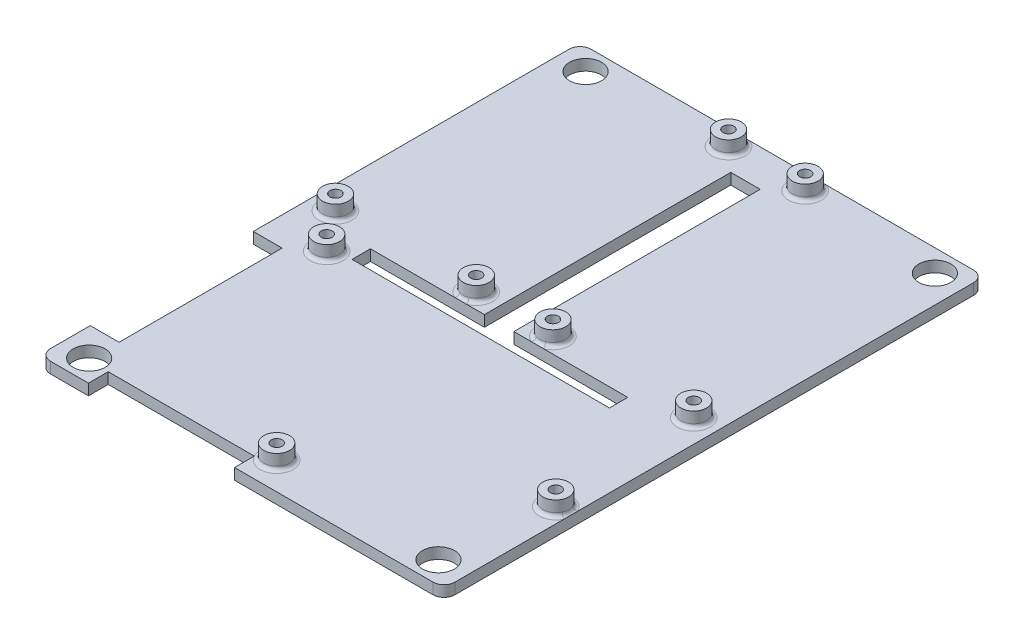
from build123d import *

# Parameters (mm, degrees)
CROQUIS1_W              = 110
CROQUIS1_H              = 147
CROQUIS1_R              = 4.35
SALIENTE_EXTRUIR1_DEPTH = 3
CROQUIS3_R              = 3.5
CROQUIS3_R_2            = 1.5
SALIENTE_EXTRUIR2_DEPTH = 4
REDONDEO1_R             = 3
REDONDEO2_R             = 1
CROQUIS4_W              = 39.735269825
CROQUIS4_H              = 5.382394585
CROQUIS4_W_2            = 7.840880328
CROQUIS4_H_2            = 44.360539328
CORTAR_EXTRUIR1_DEPTH   = 184.643676864


with BuildPart() as part:
    # Croquis1 → Saliente-Extruir1 (new body)
    with BuildSketch(Plane(origin=(0, 0, 0), x_dir=(1, 0, 0), z_dir=(0, 1, 0))):
        with Locations((55, 73.5)):
            Rectangle(CROQUIS1_W, CROQUIS1_H)
        with Locations(Location((7.5, 141, 0), (0, 0, 270))):
            Circle(CROQUIS1_R, mode=Mode.SUBTRACT)
        with Locations(Location((102.5, 141, 0), (0, 0, 270))):
            Circle(CROQUIS1_R, mode=Mode.SUBTRACT)
        with Locations(Location((102.5, 6, 0), (0, 0, 270))):
            Circle(CROQUIS1_R, mode=Mode.SUBTRACT)
        with Locations(Location((7.5, 6, 0), (0, 0, 270))):
            Circle(CROQUIS1_R, mode=Mode.SUBTRACT)
        Polygon((90, 65), (20, 65), (20, 70), (51, 70), (51, 137), (59, 137), (59, 70), (90, 70), align=None, mode=Mode.SUBTRACT)
    extrude(amount=SALIENTE_EXTRUIR1_DEPTH)

    # Croquis3 → Saliente-Extruir2 (add)
    # profile 1 of 9: a face of its own
    with BuildSketch(Plane(origin=(0, 3, 0), x_dir=(1, 0, 0), z_dir=(0, 1, 0))):
        with Locations(Location((14.6, 63.5, 0), (0, 0, 90))):
            Circle(CROQUIS3_R)
        with Locations(Location((14.6, 63.5, 0), (0, 0, 270))):
            Circle(CROQUIS3_R_2, mode=Mode.SUBTRACT)
    # profile 2 of 9: a face of its own
    with BuildSketch(Plane(origin=(0, 3, 0), x_dir=(1, 0, 0), z_dir=(0, 1, 0))):
        with Locations(Location((6.275, 74.2, 0), (0, 0, 90))):
            Circle(CROQUIS3_R)
        with Locations(Location((6.275, 74.2, 0), (0, 0, 270))):
            Circle(CROQUIS3_R_2, mode=Mode.SUBTRACT)
    # profile 3 of 9: a face of its own
    with BuildSketch(Plane(origin=(0, 3, 0), x_dir=(1, 0, 0), z_dir=(0, 1, 0))):
        with Locations(Location((105.9, 34.5, 0), (0, 0, 90))):
            Circle(CROQUIS3_R)
        with Locations(Location((105.9, 34.5, 0), (0, 0, 270))):
            Circle(CROQUIS3_R_2, mode=Mode.SUBTRACT)
    # profile 4 of 9: a face of its own
    with BuildSketch(Plane(origin=(0, 3, 0), x_dir=(1, 0, 0), z_dir=(0, 1, 0))):
        with Locations(Location((103.725, 74.2, 0), (0, 0, 90))):
            Circle(CROQUIS3_R)
        with Locations(Location((103.725, 74.2, 0), (0, 0, 270))):
            Circle(CROQUIS3_R_2, mode=Mode.SUBTRACT)
    # profile 5 of 9: a face of its own
    with BuildSketch(Plane(origin=(0, 3, 0), x_dir=(1, 0, 0), z_dir=(0, 1, 0))):
        with Locations(Location((44.575, 74.2, 0), (0, 0, 90))):
            Circle(CROQUIS3_R)
        with Locations(Location((44.575, 74.2, 0), (0, 0, 270))):
            Circle(CROQUIS3_R_2, mode=Mode.SUBTRACT)
    # profile 6 of 9: a face of its own
    with BuildSketch(Plane(origin=(0, 3, 0), x_dir=(1, 0, 0), z_dir=(0, 1, 0))):
        with Locations(Location((44.575, 142.8, 0), (0, 0, 90))):
            Circle(CROQUIS3_R)
        with Locations(Location((44.575, 142.8, 0), (0, 0, 270))):
            Circle(CROQUIS3_R_2, mode=Mode.SUBTRACT)
    # profile 7 of 9: a face of its own
    with BuildSketch(Plane(origin=(0, 3, 0), x_dir=(1, 0, 0), z_dir=(0, 1, 0))):
        with Locations(Location((65.425, 74.2, 0), (0, 0, 90))):
            Circle(CROQUIS3_R)
        with Locations(Location((65.425, 74.2, 0), (0, 0, 270))):
            Circle(CROQUIS3_R_2, mode=Mode.SUBTRACT)
    # profile 8 of 9: a face of its own
    with BuildSketch(Plane(origin=(0, 3, 0), x_dir=(1, 0, 0), z_dir=(0, 1, 0))):
        with Locations(Location((65.425, 142.8, 0), (0, 0, 90))):
            Circle(CROQUIS3_R)
        with Locations(Location((65.425, 142.8, 0), (0, 0, 270))):
            Circle(CROQUIS3_R_2, mode=Mode.SUBTRACT)
    # profile 9 of 9: a face of its own
    with BuildSketch(Plane(origin=(0, 3, 0), x_dir=(1, 0, 0), z_dir=(0, 1, 0))):
        with Locations(Location((57, 7.5, 0), (0, 0, 90))):
            Circle(CROQUIS3_R)
        with Locations(Location((57, 7.5, 0), (0, 0, 270))):
            Circle(CROQUIS3_R_2, mode=Mode.SUBTRACT)
    extrude(amount=SALIENTE_EXTRUIR2_DEPTH)

    # Redondeo1
    redondeo1_edges = [part.edges().sort_by_distance(p)[0] for p in [
        (0, 1.5, -147),
        (110, 1.5, -147),
        (110, 1.5, 0),
        (0, 1.5, 0),
    ]]
    fillet(redondeo1_edges, radius=REDONDEO1_R)

    # Redondeo2
    redondeo2_edges = [part.edges().sort_by_distance(p)[0] for p in [
        (65.425, 3, -70.7),
        (65.425, 3, -139.3),
        (57, 3, -4),
        (14.6, 3, -60),
        (6.275, 3, -70.7),
        (105.9, 3, -31),
        (103.725, 3, -70.7),
        (44.575, 3, -70.7),
        (44.575, 3, -139.3),
    ]]
    fillet(redondeo2_edges, radius=REDONDEO2_R)

    # Croquis4 → Cortar-Extruir1 (cut, through all)
    with BuildSketch(Plane(origin=(0, 3, 0), x_dir=(1, 0, 0), z_dir=(0, 1, 0))):
        with Locations((33.174742835, 2.691197293)):
            Rectangle(CROQUIS4_W, CROQUIS4_H)
        with Locations((3.920440164, 35.972245165)):
            Rectangle(CROQUIS4_W_2, CROQUIS4_H_2)
    extrude(amount=-CORTAR_EXTRUIR1_DEPTH, mode=Mode.SUBTRACT)


solid = part.part
